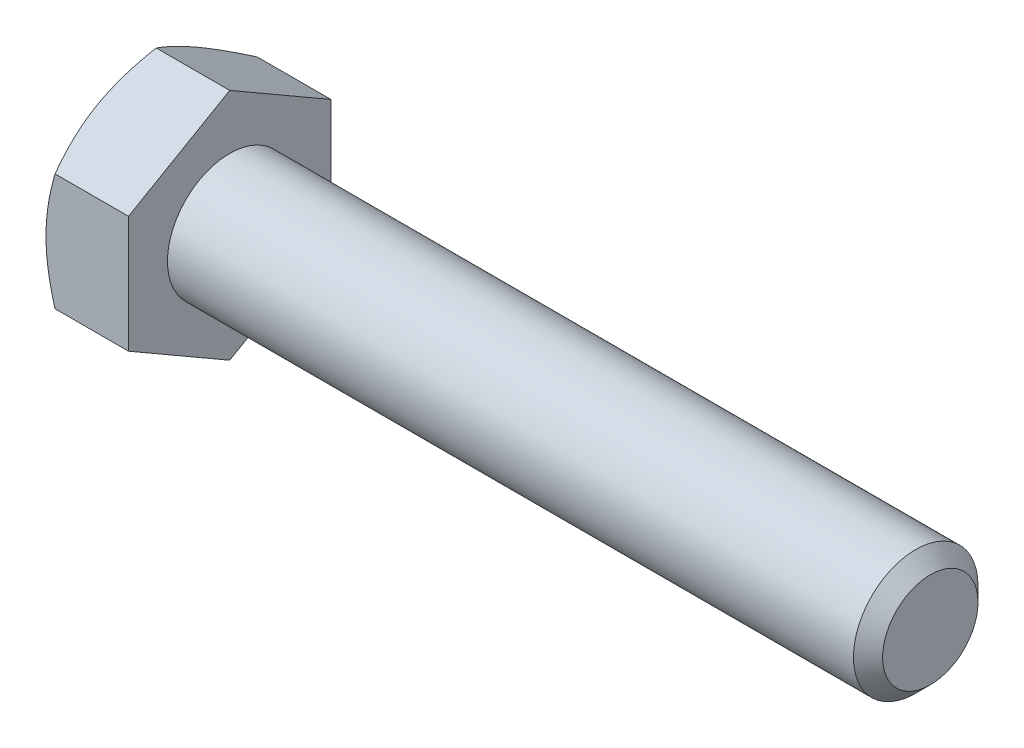
from build123d import *

# Parameters (mm, degrees)
SKETCH2_R           = 4
BOSS_EXTRUDE1_DEPTH = 45
CHAMFER1_SIZE       = 0.9375
BOSS_EXTRUDE2_DEPTH = 5.3
SKETCH6_OUTSIDE_W   = 206.886
SKETCH6_OUTSIDE_H   = 208.898
SKETCH6_OUTSIDE_R   = 6.5
CUT_EXTRUDE1_DEPTH  = 52.27058936
CUT_EXTRUDE1_DRAFT  = -60


with BuildPart() as part:
    # Sketch2 → Boss-Extrude1 (new body)
    with BuildSketch(Plane(origin=(25.15, 0, 0), x_dir=(0, 0, -1), z_dir=(1, 0, 0))):
        Circle(SKETCH2_R)
    extrude(amount=-BOSS_EXTRUDE1_DEPTH)

    # Chamfer1
    chamfer1_edges = [part.edges().sort_by_distance(p)[0] for p in [
        (25.15, 0, 4),
    ]]
    chamfer(chamfer1_edges, length=CHAMFER1_SIZE)

    # Sketch3 → Boss-Extrude2 (add)
    with BuildSketch(Plane.ZY.offset(19.85)):
        Polygon((-6.5, -3.75277675), (0, -7.505553499), (6.5, -3.75277675), (6.5, 3.75277675), (0, 7.505553499), (-6.5, 3.75277675), align=None)
    extrude(amount=BOSS_EXTRUDE2_DEPTH)


with BuildPart() as cut_extrude1_tool:
    # Sketch6 outside → Cut-Extrude1 (with draft: the straight prism first)
    with BuildSketch(Plane.ZY.offset(25.15)):
        Rectangle(SKETCH6_OUTSIDE_W, SKETCH6_OUTSIDE_H)
        Circle(SKETCH6_OUTSIDE_R, mode=Mode.SUBTRACT)
    extrude(amount=-CUT_EXTRUDE1_DEPTH)
    # Cut-Extrude1: the draft: its side faces are tilted about the plane it starts from
    cut_extrude1_sides = [cut_extrude1_tool.faces().sort_by_distance(p)[0] for p in [
        (0.98529468, -104.449, 0),
        (0.98529468, 0, 103.443),
        (0.98529468, 104.449, 0),
        (0.98529468, 0, -103.443),
        (0.98529468, 0, -6.5),
    ]]
    draft(cut_extrude1_sides, Plane.ZY.offset(25.15), CUT_EXTRUDE1_DRAFT)


with BuildPart() as part_1:
    add(part.part)

    # Cut-Extrude1: cut by cut_extrude1_tool
    add(cut_extrude1_tool.part, mode=Mode.SUBTRACT)


solid = part_1.part
